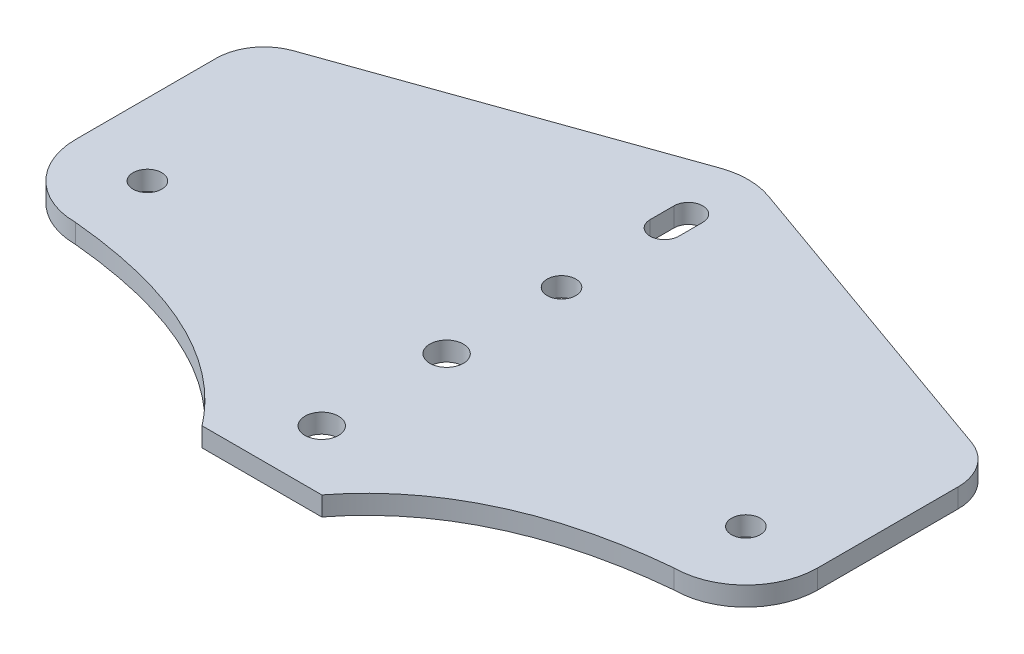
from build123d import *

# Parameters (mm, degrees)
SKETCH2_R              = 3
SKETCH2_R_2            = 3.5
MAINPLATEEXTRUDE_DEPTH = 4


with BuildPart() as part:
    # Sketch2 → MainPlateExtrude (new body)
    with BuildSketch(Plane(origin=(0, 0, 0), x_dir=(1, 0, 0), z_dir=(0, 1, 0))):
        with BuildLine():
            Line((-81.215970545, -46.28367362), (-81.215970545, -16.925572983))
            ThreePointArc((-81.215970545, -16.925572983), (-79.384065752, -11.156498475), (-74.559526408, -7.501103014))
            Line((-74.559526408, -7.501103014), (-8.731304339, 15.853031333))
            ThreePointArc((-8.731304339, 15.853031333), (-3.715970545, 16.71632638), (1.299363248, 15.853031333))
            Line((1.299363248, 15.853031333), (67.127585317, -7.501103014))
            ThreePointArc((67.127585317, -7.501103014), (71.952124662, -11.156498475), (73.784029455, -16.925572983))
            Line((73.784029455, -16.925572983), (73.784029455, -46.28367362))
            ThreePointArc((73.784029455, -46.28367362), (69.390631173, -56.890275338), (58.784029455, -61.28367362))
            add(Edge.make_bspline(
                [(58.784029455, -61.28367362), (24.556467528, -64.469839896), (8.784029455, -84.862635588)],
                knots=[0, 0, 0, 0.615675344, 0.615675344, 0.615675344], degree=2))
            Line((8.784029455, -84.862635588), (-16.215970545, -84.862635588))
            add(Edge.make_bspline(
                [(-66.215970545, -61.28367362), (-31.988408619, -64.469839896), (-16.215970545, -84.862635588)],
                knots=[0, 0, 0, 0.615675344, 0.615675344, 0.615675344], degree=2))
            ThreePointArc((-66.215970545, -61.28367362), (-76.822572263, -56.890275338), (-81.215970545, -46.28367362))
        make_face()
        with Locations(Location((-66.215970545, -46.28367362, 0), (0, 0, 270))):
            Circle(SKETCH2_R, mode=Mode.SUBTRACT)
        with Locations(Location((58.784029455, -46.28367362, 0), (0, 0, 270))):
            Circle(SKETCH2_R, mode=Mode.SUBTRACT)
        with Locations(Location((-3.715970545, -46.28367362, 0), (0, 0, 270))):
            Circle(SKETCH2_R_2, mode=Mode.SUBTRACT)
        with Locations(Location((-3.715970545, -72.362635588, 0), (0, 0, 270))):
            Circle(SKETCH2_R_2, mode=Mode.SUBTRACT)
        with Locations(Location((-3.715970545, -22.28367362, 0), (0, 0, 270))):
            Circle(SKETCH2_R, mode=Mode.SUBTRACT)
        with BuildLine():
            Line((-0.715970545, 4.21632638), (-0.715970545, -0.78367362))
            ThreePointArc((-0.715970545, -0.78367362), (-3.715970545, -3.78367362), (-6.715970545, -0.78367362))
            Line((-6.715970545, -0.78367362), (-6.715970545, 4.21632638))
            ThreePointArc((-6.715970545, 4.21632638), (-3.715970545, 7.21632638), (-0.715970545, 4.21632638))
        make_face(mode=Mode.SUBTRACT)
    extrude(amount=MAINPLATEEXTRUDE_DEPTH)


solid = part.part
